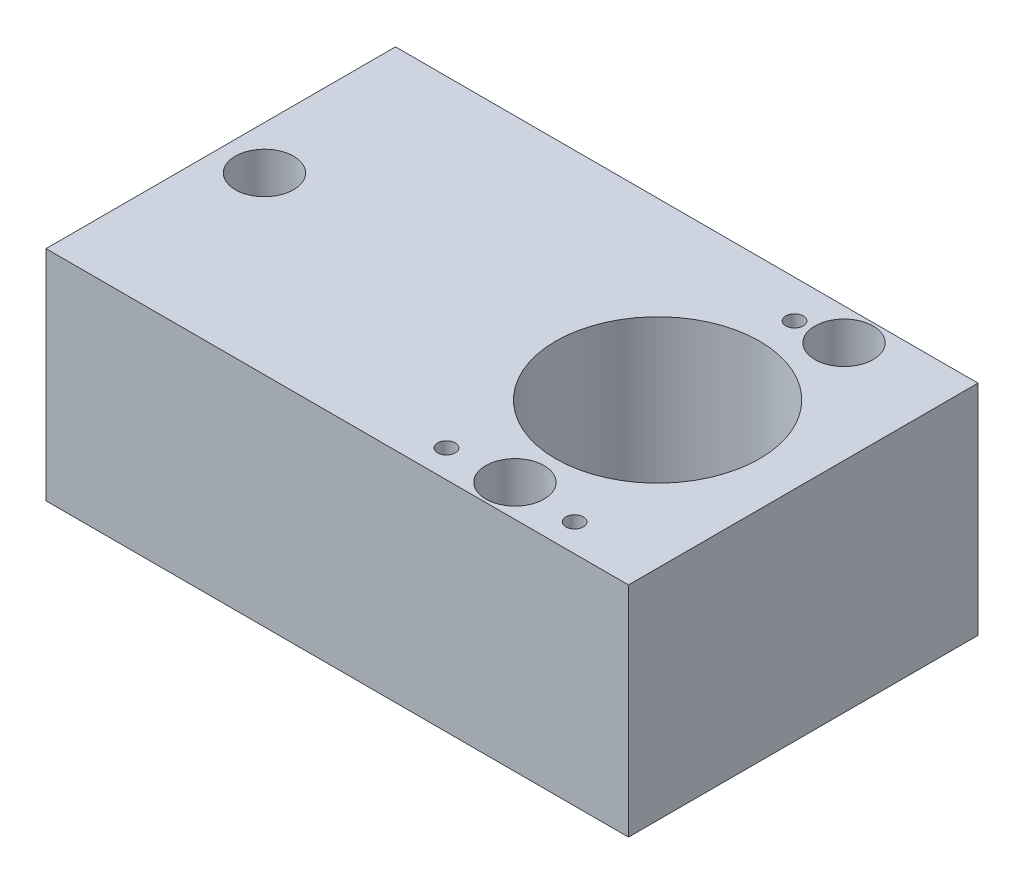
from build123d import *

# Parameters (mm, degrees)
SKETCH_1_W          = 20
SKETCH_1_H          = 12
EXTRUDE_1_DEPTH     = 2.5
SKETCH_1_9_R        = 0.55
SKETCH_1_9_R_2      = 2.55
CUT_EXTRUDE_3_DEPTH = 2.5
EXTRUDE_START       = 2.5
SKETCH_1_10_W       = 20
SKETCH_1_10_H       = 12
SKETCH_1_10_R       = 3.5
EXTRUDE_2_DEPTH     = 5
SKETCH_2_R          = 0.7
CUT_EXTRUDE_4_DEPTH = 25.5
CUT_EXTRUDE_START   = -7.5
SKETCH_2_3_R        = 1
CUT_EXTRUDE_5_DEPTH = 5.5
SKETCH_2_6_R        = 0.3
CUT_EXTRUDE_6_DEPTH = 6


with BuildPart() as part:
    # 草图1 → 凸台-拉伸1 (new body)
    with BuildSketch(Plane(origin=(0, 0, 0), x_dir=(1, 0, 0), z_dir=(0, 1, 0))):
        with Locations((10, -6)):
            Rectangle(SKETCH_1_W, SKETCH_1_H)
    extrude(amount=EXTRUDE_1_DEPTH)

    # 草图1<9> → 切除-拉伸3 (cut)
    with BuildSketch(Plane(origin=(0, 0, 0), x_dir=(1, 0, 0), z_dir=(0, 1, 0))):
        with Locations(Location((8.340658618, -8.2, 0), (0, 0, 270))):
            Circle(SKETCH_1_9_R)
        with Locations(Location((10.72985855, -3.807765525, 0), (0, 0, 270))):
            Circle(SKETCH_1_9_R)
        with Locations(Location((15, -6, 0), (0, 0, 270))):
            Circle(SKETCH_1_9_R_2)
    extrude(amount=CUT_EXTRUDE_3_DEPTH, mode=Mode.SUBTRACT)

    # 草图1<10> → 凸台-拉伸2 (add)
    with BuildSketch(Plane(origin=(0, 0, 0), x_dir=(1, 0, 0), z_dir=(0, 1, 0)).offset(EXTRUDE_START)):
        with Locations((10, -6)):
            Rectangle(SKETCH_1_10_W, SKETCH_1_10_H)
        with Locations(Location((15, -6, 0), (0, 0, 90))):
            Circle(SKETCH_1_10_R, mode=Mode.SUBTRACT)
    extrude(amount=EXTRUDE_2_DEPTH)

    # 草图2 → 切除-拉伸4 (cut, through all)
    with BuildSketch(Plane.XZ):
        with Locations(Location((15, 10.9, 0), (0, 0, 270))):
            Circle(SKETCH_2_R)
        with Locations(Location((1.5, 6, 0), (0, 0, 270))):
            Circle(SKETCH_2_R)
        with Locations(Location((16.5, 1.1, 0), (0, 0, 270))):
            Circle(SKETCH_2_R)
    extrude(amount=-CUT_EXTRUDE_4_DEPTH, mode=Mode.SUBTRACT)

    # 草图2<3> → 切除-拉伸5 (cut)
    with BuildSketch(Plane.XZ.offset(CUT_EXTRUDE_START)):
        with Locations(Location((16.5, 1.1, 0), (0, 0, 90))):
            Circle(SKETCH_2_3_R)
        with Locations(Location((15, 10.9, 0), (0, 0, 90))):
            Circle(SKETCH_2_3_R)
        with Locations(Location((1.5, 6, 0), (0, 0, 90))):
            Circle(SKETCH_2_3_R)
    extrude(amount=CUT_EXTRUDE_5_DEPTH, mode=Mode.SUBTRACT)

    # 草图2<6> → 切除-拉伸6 (cut)
    with BuildSketch(Plane.XZ.offset(CUT_EXTRUDE_START)):
        with Locations(Location((12.8, 11.05, 0), (0, 0, 90))):
            Circle(SKETCH_2_6_R)
        with Locations(Location((17.2, 11.05, 0), (0, 0, 90))):
            Circle(SKETCH_2_6_R)
        with Locations(Location((15, 1.3, 0), (0, 0, 90))):
            Circle(SKETCH_2_6_R)
    extrude(amount=CUT_EXTRUDE_6_DEPTH, mode=Mode.SUBTRACT)


solid = part.part
